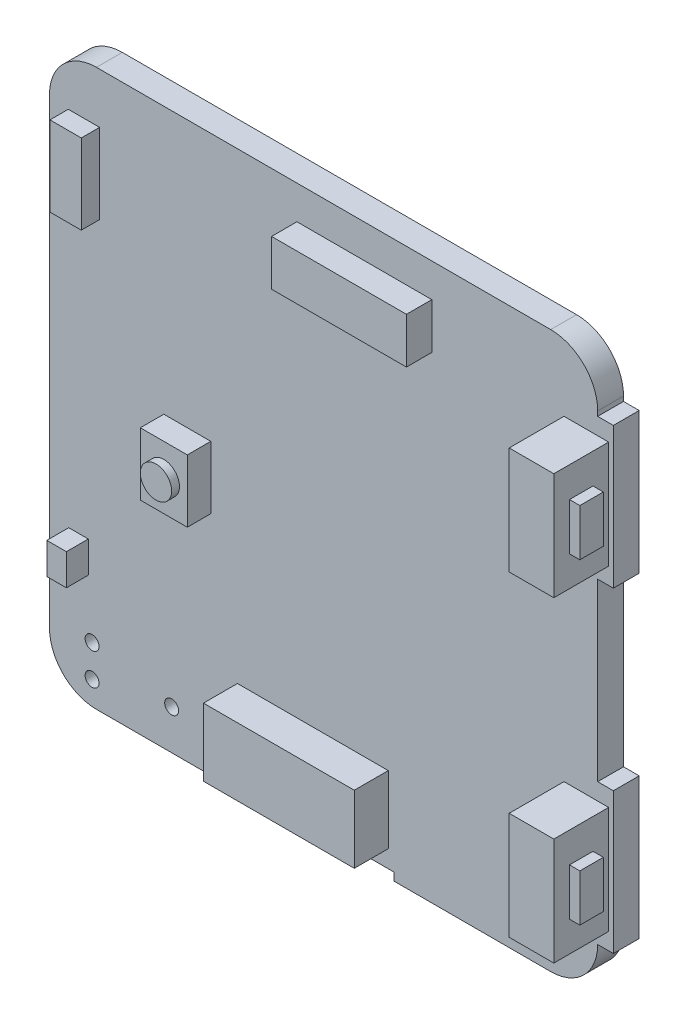
from build123d import *

# Parameters (mm, degrees)
MODEL_R             = 0.4445
MODEL_R_2           = 0.3
BOSS_EXTRUDE1_DEPTH = 1.65
SKETCH2_W           = 2.85
SKETCH2_H           = 6.858
BOSS_EXTRUDE2_DEPTH = 3.5
SKETCH3_W           = 1.5
SKETCH3_H           = 3
BOSS_EXTRUDE3_DEPTH = 0.66
SKETCH4_W           = 1.25
SKETCH4_H           = 2
BOSS_EXTRUDE4_DEPTH = 1.4
SKETCH5_W           = 2
SKETCH5_H           = 5.1
BOSS_EXTRUDE5_DEPTH = 1.17
SKETCH6_W           = 8.61
SKETCH6_H           = 2.92
BOSS_EXTRUDE6_DEPTH = 1.62
SKETCH7_W           = 9.63
SKETCH7_H           = 4.32
BOSS_EXTRUDE7_DEPTH = 2.17
SKETCH8_W           = 3
SKETCH8_H           = 4
BOSS_EXTRUDE8_DEPTH = 1.5
SKETCH9_R           = 1
BOSS_EXTRUDE9_DEPTH = 0.5


with BuildPart() as part:
    # Model → Boss-Extrude1 (new body)
    with BuildSketch(Plane.XY):
        with BuildLine():
            Line((3, 35.5), (32, 35.5))
            ThreePointArc((32, 35.5), (34.121320344, 34.621320344), (35, 32.5))
            Line((35, 32.5), (35, 32.2))
            Line((35, 32.2), (36, 32.2))
            Line((36, 32.2), (36, 23.2))
            Line((36, 23.2), (35, 23.2))
            Line((35, 23.2), (35, 12))
            Line((35, 12), (36, 12))
            Line((36, 12), (36, 3))
            Line((36, 3), (35, 3))
            ThreePointArc((35, 3), (34.121320344, 0.878679656), (32, 0))
            Line((32, 0), (22, 0))
            Line((22, 0), (22, 0.5))
            Line((22, 0.5), (11.1, 0.5))
            Line((11.1, 0.5), (11.1, 0))
            Line((11.1, 0), (3, 0))
            ThreePointArc((3, 0), (0.878679656, 0.878679656), (0, 3))
            Line((0, 3), (0, 32.5))
            ThreePointArc((0, 32.5), (0.878679656, 34.621320344), (3, 35.5))
        make_face()
        with Locations((7.8, 2.54)):
            Circle(MODEL_R, mode=Mode.SUBTRACT)
        with Locations((2.72, 1.524)):
            Circle(MODEL_R, mode=Mode.SUBTRACT)
        with Locations((2.72, 3.556)):
            Circle(MODEL_R, mode=Mode.SUBTRACT)
        with Locations((17, 32.3)):
            Circle(MODEL_R_2, mode=Mode.SUBTRACT)
        with Locations((23.54, 32.3)):
            Circle(MODEL_R_2, mode=Mode.SUBTRACT)
        with Locations((30.76, 25.494)):
            Circle(MODEL_R_2, mode=Mode.SUBTRACT)
    extrude(amount=BOSS_EXTRUDE1_DEPTH)

    # Sketch2 → Boss-Extrude2 (add)
    with BuildSketch(Plane.XY.offset(1.65)):
        with Locations((34.275, 27.7)):
            Rectangle(SKETCH2_W, SKETCH2_H)
        with Locations((34.275, 7.5)):
            Rectangle(SKETCH2_W, SKETCH2_H)
    extrude(amount=BOSS_EXTRUDE2_DEPTH)

    # Sketch3 → Boss-Extrude3 (add)
    with BuildSketch(Plane(origin=(35.7, 0, 0), x_dir=(0, 0, -1), z_dir=(1, 0, 0))):
        with Locations((-3.4, 27.7)):
            Rectangle(SKETCH3_W, SKETCH3_H)
        with Locations((-3.4, 7.5)):
            Rectangle(SKETCH3_W, SKETCH3_H)
    extrude(amount=BOSS_EXTRUDE3_DEPTH)

    # Sketch4 → Boss-Extrude4 (add)
    with BuildSketch(Plane.XY.offset(1.65)):
        with Locations((1.855, 8.16)):
            Rectangle(SKETCH4_W, SKETCH4_H)
    extrude(amount=BOSS_EXTRUDE4_DEPTH)

    # Sketch5 → Boss-Extrude5 (add)
    with BuildSketch(Plane.XY.offset(1.65)):
        with Locations((2.2, 29.73)):
            Rectangle(SKETCH5_W, SKETCH5_H)
    extrude(amount=BOSS_EXTRUDE5_DEPTH)

    # Sketch6 → Boss-Extrude6 (add)
    with BuildSketch(Plane.XY.offset(1.65)):
        with Locations((20.105, 31.9)):
            Rectangle(SKETCH6_W, SKETCH6_H)
    extrude(amount=BOSS_EXTRUDE6_DEPTH)

    # Sketch7 → Boss-Extrude7 (add)
    with BuildSketch(Plane.XY.offset(1.65)):
        with Locations((16.815, 3.77)):
            Rectangle(SKETCH7_W, SKETCH7_H)
    extrude(amount=BOSS_EXTRUDE7_DEPTH)

    # Sketch8 → Boss-Extrude8 (add)
    with BuildSketch(Plane.XY.offset(1.65)):
        with Locations((8.8, 16.47)):
            Rectangle(SKETCH8_W, SKETCH8_H)
    extrude(amount=BOSS_EXTRUDE8_DEPTH)

    # Sketch9 → Boss-Extrude9 (add)
    with BuildSketch(Plane.XY.offset(3.15)):
        with Locations((8.8, 16.47)):
            Circle(SKETCH9_R)
    extrude(amount=BOSS_EXTRUDE9_DEPTH)


solid = part.part
